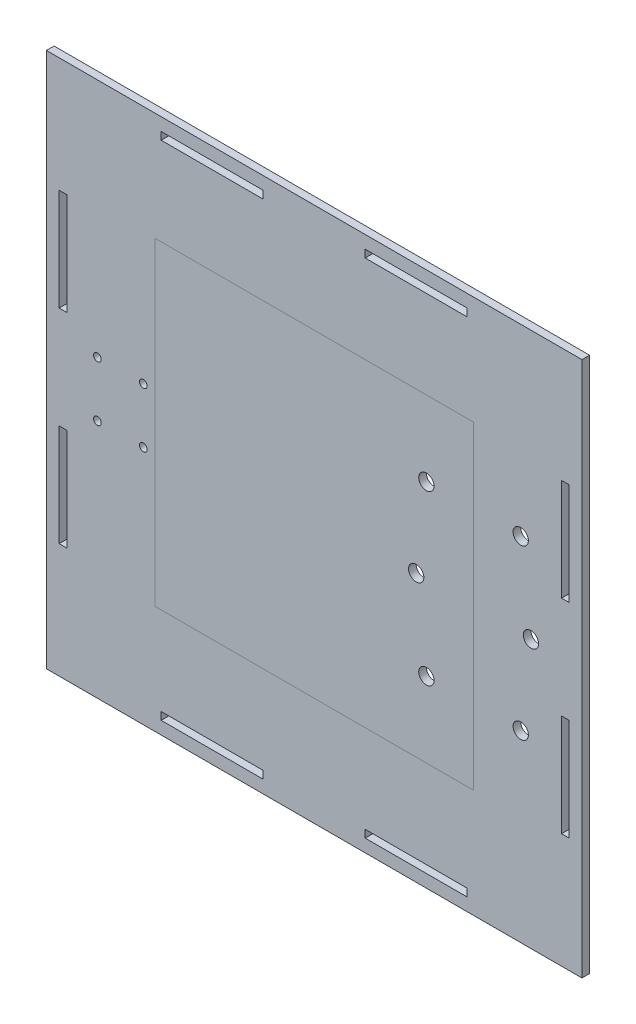
from build123d import *

# Parameters (mm, degrees)
SKETCH_1_W      = 210
SKETCH_1_H      = 210
SKETCH_1_W_2    = 3
SKETCH_1_H_2    = 40
SKETCH_1_W_3    = 40
SKETCH_1_H_3    = 3
SKETCH_1_W_4    = 125
SKETCH_1_H_4    = 125
SKETCH_1_R      = 1.5
SKETCH_1_R_2    = 3
EXTRUDE_1_DEPTH = 3
SKETCH_1_3_W    = 125
SKETCH_1_3_H    = 125
SKETCH_1_3_R    = 3
EXTRUDE_2_DEPTH = 3


with BuildPart() as part:
    # 草图1 → 凸台-拉伸1 (new body)
    with BuildSketch(Plane.XY):
        with Locations((100, -100)):
            Rectangle(SKETCH_1_W, SKETCH_1_H)
        with Locations((1.5, -60)):
            Rectangle(SKETCH_1_W_2, SKETCH_1_H_2, mode=Mode.SUBTRACT)
        with Locations((60, -1.5)):
            Rectangle(SKETCH_1_W_3, SKETCH_1_H_3, mode=Mode.SUBTRACT)
        with Locations((100, -100)):
            Rectangle(SKETCH_1_W_4, SKETCH_1_H_4, mode=Mode.SUBTRACT)
        with Locations((1.5, -140)):
            Rectangle(SKETCH_1_W_2, SKETCH_1_H_2, mode=Mode.SUBTRACT)
        with Locations((140, -1.5)):
            Rectangle(SKETCH_1_W_3, SKETCH_1_H_3, mode=Mode.SUBTRACT)
        with Locations((198.5, -60)):
            Rectangle(SKETCH_1_W_2, SKETCH_1_H_2, mode=Mode.SUBTRACT)
        with Locations((33, -89.2)):
            Circle(SKETCH_1_R, mode=Mode.SUBTRACT)
        with Locations((15, -89.2)):
            Circle(SKETCH_1_R, mode=Mode.SUBTRACT)
        with Locations((60, -198.5)):
            Rectangle(SKETCH_1_W_3, SKETCH_1_H_3, mode=Mode.SUBTRACT)
        with Locations((140, -198.5)):
            Rectangle(SKETCH_1_W_3, SKETCH_1_H_3, mode=Mode.SUBTRACT)
        with Locations((198.5, -140)):
            Rectangle(SKETCH_1_W_2, SKETCH_1_H_2, mode=Mode.SUBTRACT)
        with Locations((181, -67)):
            Circle(SKETCH_1_R_2, mode=Mode.SUBTRACT)
        with Locations((185, -100)):
            Circle(SKETCH_1_R_2, mode=Mode.SUBTRACT)
        with Locations((33, -110.8)):
            Circle(SKETCH_1_R, mode=Mode.SUBTRACT)
        with Locations((15, -110.8)):
            Circle(SKETCH_1_R, mode=Mode.SUBTRACT)
        with Locations((181, -133)):
            Circle(SKETCH_1_R_2, mode=Mode.SUBTRACT)
    extrude(amount=EXTRUDE_1_DEPTH)


with BuildPart() as body_2:
    # 草图1<3> → 凸台-拉伸2 (new body)
    with BuildSketch(Plane.XY):
        with Locations((100, -100)):
            Rectangle(SKETCH_1_3_W, SKETCH_1_3_H)
        with Locations((144, -67)):
            Circle(SKETCH_1_3_R, mode=Mode.SUBTRACT)
        with Locations((140, -100)):
            Circle(SKETCH_1_3_R, mode=Mode.SUBTRACT)
        with Locations((144, -133)):
            Circle(SKETCH_1_3_R, mode=Mode.SUBTRACT)
    extrude(amount=EXTRUDE_2_DEPTH)


solid = Compound([part.part, body_2.part])
